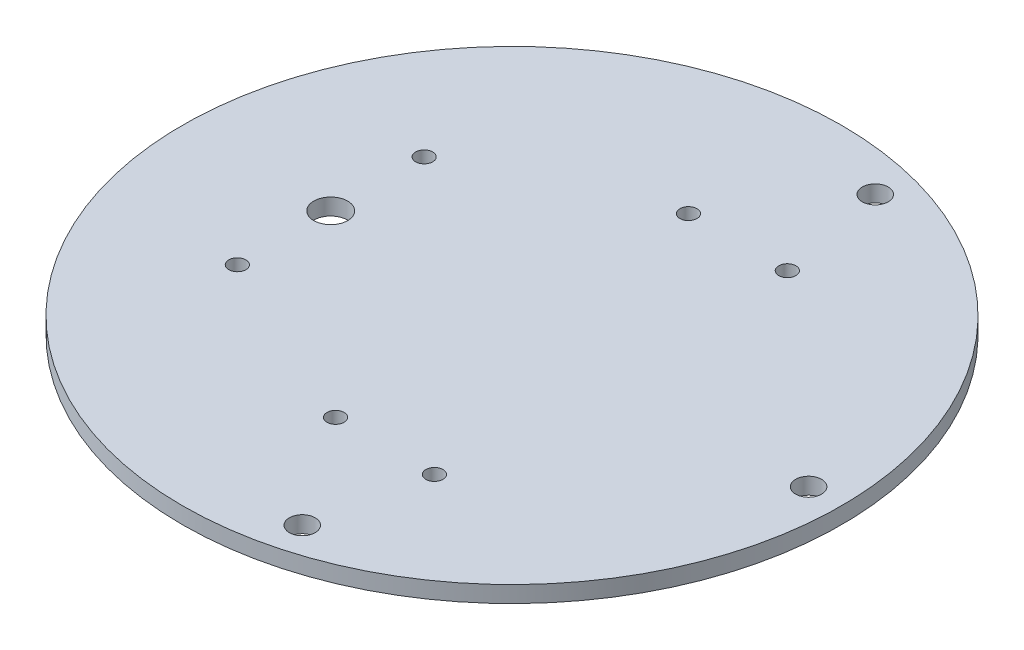
from build123d import *

# Parameters (mm, degrees)
SKETCH1_R                   = 63.5
BOSS_EXTRUDE1_DEPTH         = 3.175
TAP_DRILL_FOR_M4X0_7_TAP1_D = 3.3
F_9_0_196_DIAMETER_HOLE1_D  = 4.9784
CUT_EXTRUDE1_DEPTH          = 90.858670283
CUT_EXTRUDE1_DEPTH_BACK     = 90.858670283
SKETCH12_R                  = 3.2639
SKETCH12_R_2                = 1.65


with BuildPart() as part:
    # Sketch1 → Boss-Extrude1 (new body)
    with BuildSketch(Plane(origin=(0, 0, 0), x_dir=(1, 0, 0), z_dir=(0, 1, 0))):
        with Locations(Location((0, 0, 0), (0, 0, 270))):
            Circle(SKETCH1_R)
    extrude(amount=BOSS_EXTRUDE1_DEPTH)

    # Tap Drill for M4x0.7 Tap1 (through all)
    with Locations(Plane(origin=(0, 3.175, 0), x_dir=(1, 0, 0), z_dir=(0, 1, 0))):
        with Locations((0, 34), (0, -34)):
            Hole(TAP_DRILL_FOR_M4X0_7_TAP1_D / 2)

    # #9 (0.196) Diameter Hole1 (through all)
    with Locations(Plane(origin=(0, 3.175, 0), x_dir=(1, 0, 0), z_dir=(0, 1, 0))):
        with Locations((14.791508428, 55.202660972), (57.15, 0), (14.791508428, -55.202660972)):
            Hole(F_9_0_196_DIAMETER_HOLE1_D / 2)

    # Sketch12 → Cut-Extrude1 (cut, two sides: drawn at the far end of the back side and taken through both)
    with BuildSketch(Plane(origin=(0, 3.175, 0), x_dir=(1, 0, 0), z_dir=(0, 1, 0)).offset(-CUT_EXTRUDE1_DEPTH_BACK)):
        with Locations(Location((-34.925, 0, 0), (0, 0, 270))):
            Circle(SKETCH12_R)
        with Locations(Location((-34.925, 17.9999894, 0), (0, 0, 270))):
            Circle(SKETCH12_R_2)
        with Locations(Location((-34.925, -17.9999894, 0), (0, 0, 270))):
            Circle(SKETCH12_R_2)
        with Locations(Location((19.05, 34, 0), (0, 0, 270))):
            Circle(SKETCH12_R_2)
        with Locations(Location((19.05, -34, 0), (0, 0, 270))):
            Circle(SKETCH12_R_2)
    extrude(amount=CUT_EXTRUDE1_DEPTH + CUT_EXTRUDE1_DEPTH_BACK, mode=Mode.SUBTRACT)


solid = part.part
